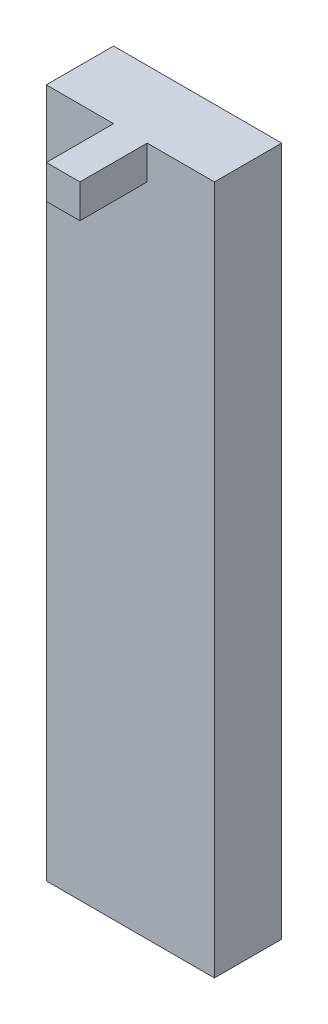
from build123d import *

# Parameters (mm, degrees)
BOSS_EXTRUDE1_DEPTH = 10
SKETCH1_3_W         = 5
SKETCH1_3_H         = 5
BOSS_EXTRUDE2_DEPTH = 20


with BuildPart() as part:
    # Sketch1 → Boss-Extrude1 (new body)
    with BuildSketch(Plane.XY):
        Polygon((-25, 0), (0, 0), (0, 102.5), (-10, 102.5), (-10, 97.5), (-15, 97.5), (-15, 102.5), (-25, 102.5), align=None)
    extrude(amount=BOSS_EXTRUDE1_DEPTH)

    # Sketch1<3> → Boss-Extrude2 (add)
    with BuildSketch(Plane.XY):
        with Locations((-12.5, 100)):
            Rectangle(SKETCH1_3_W, SKETCH1_3_H)
    extrude(amount=BOSS_EXTRUDE2_DEPTH)


solid = part.part
